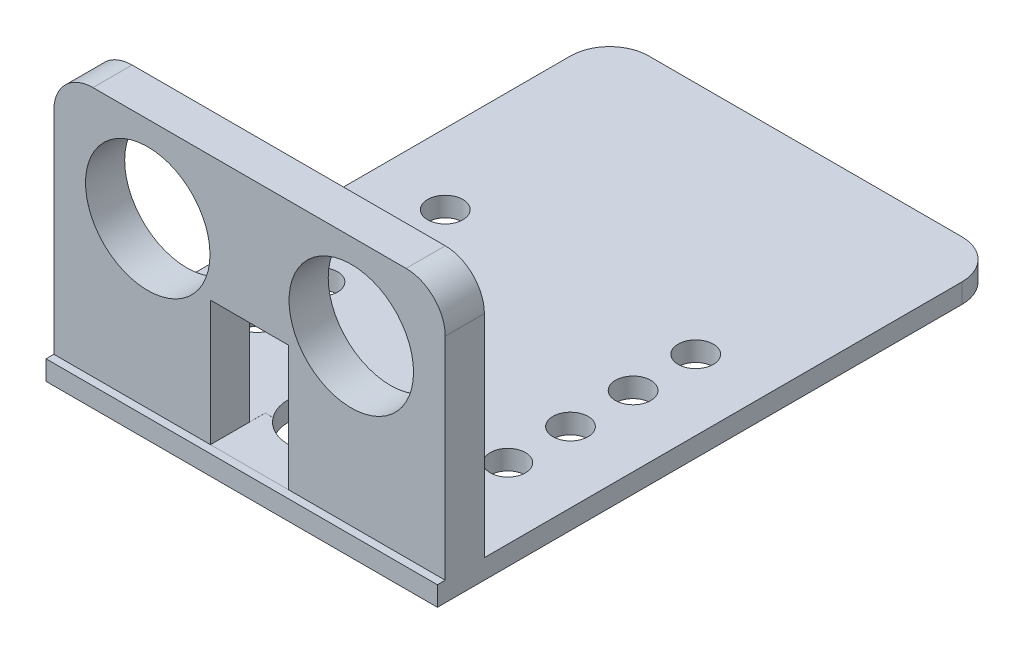
from build123d import *

# Parameters (mm, degrees)
SKETCH1_R           = 2.25
BOSS_EXTRUDE1_DEPTH = 2.5
SKETCH3_W           = 50
SKETCH3_H           = 5
BOSS_EXTRUDE2_DEPTH = 32
SKETCH7_R           = 5
CUT_EXTRUDE3_DEPTH  = 7
SKETCH5_R           = 7.95
SKETCH5_W           = 10
SKETCH5_H           = 16
CUT_EXTRUDE1_DEPTH  = 7
SKETCH8_W           = 50
SKETCH8_H           = 18
CUT_EXTRUDE4_DEPTH  = 46.265881191
SKETCH9_W           = 50
SKETCH9_H           = 2.5
BOSS_EXTRUDE3_DEPTH = 50
SKETCH10_R          = 2.25
CUT_EXTRUDE5_DEPTH  = 81.925892025
FILLET1_R           = 5


with BuildPart() as part:
    # Sketch1 → Boss-Extrude1 (new body)
    with BuildSketch(Plane(origin=(0, 0, 0), x_dir=(1, 0, 0), z_dir=(0, 1, 0))):
        Polygon((-12, -20), (12, -20), (12, -2), (16, -2), (16, -20), (25, -20), (25, 20), (-25, 20), (-25, -20), (-16, -20), (-16, -2), (-12, -2), align=None)
        with Locations(Location((-16, 16, 0), (0, 0, 270))):
            Circle(SKETCH1_R, mode=Mode.SUBTRACT)
        with Locations(Location((-16, 8, 0), (0, 0, 270))):
            Circle(SKETCH1_R, mode=Mode.SUBTRACT)
        with Locations(Location((16, 16, 0), (0, 0, 270))):
            Circle(SKETCH1_R, mode=Mode.SUBTRACT)
        with Locations(Location((16, 8, 0), (0, 0, 270))):
            Circle(SKETCH1_R, mode=Mode.SUBTRACT)
    extrude(amount=BOSS_EXTRUDE1_DEPTH)

    # Sketch3 → Boss-Extrude2 (add)
    with BuildSketch(Plane(origin=(0, 2.5, 0), x_dir=(1, 0, 0), z_dir=(0, 1, 0))):
        with Locations((0, 1.5)):
            Rectangle(SKETCH3_W, SKETCH3_H)
    extrude(amount=BOSS_EXTRUDE2_DEPTH)

    # Sketch7 → Cut-Extrude3 (cut)
    with BuildSketch(Plane(origin=(0, 2.5, 0), x_dir=(1, 0, 0), z_dir=(0, 1, 0))):
        with Locations(Location((0, 9, 0), (0, 0, 270))):
            Circle(SKETCH7_R)
    extrude(amount=-CUT_EXTRUDE3_DEPTH, mode=Mode.SUBTRACT)

    # Sketch5 → Cut-Extrude1 (cut)
    with BuildSketch(Plane.XY.offset(1)):
        with Locations((-13, 23.5)):
            Circle(SKETCH5_R)
        with Locations((13, 23.5)):
            Circle(SKETCH5_R)
        with Locations((0, 10.494306312)):
            Rectangle(SKETCH5_W, SKETCH5_H)
    extrude(amount=-CUT_EXTRUDE1_DEPTH, mode=Mode.SUBTRACT)

    # Sketch8 → Cut-Extrude4 (cut, through all)
    with BuildSketch(Plane(origin=(0, 2.5, 0), x_dir=(1, 0, 0), z_dir=(0, 1, 0))):
        with Locations((0, -11)):
            Rectangle(SKETCH8_W, SKETCH8_H)
    extrude(amount=-CUT_EXTRUDE4_DEPTH, mode=Mode.SUBTRACT)

    # Sketch9 → Boss-Extrude3 (add)
    with BuildSketch(Plane(origin=(0, 0, -20), x_dir=(-1, 0, 0), z_dir=(0, 0, -1))):
        with Locations((0, 1.25)):
            Rectangle(SKETCH9_W, SKETCH9_H)
    extrude(amount=BOSS_EXTRUDE3_DEPTH)

    # Sketch10 → Cut-Extrude5 (cut, through all)
    with BuildSketch(Plane(origin=(0, 2.5, 0), x_dir=(1, 0, 0), z_dir=(0, 1, 0))):
        with Locations(Location((-16, 16, 0), (0, 0, 270))):
            Circle(SKETCH10_R)
        with Locations(Location((-16, 24, 0), (0, 0, 270))):
            Circle(SKETCH10_R)
        with Locations(Location((-16, 32, 0), (0, 0, 270))):
            Circle(SKETCH10_R)
        with Locations(Location((-16, 40, 0), (0, 0, 270))):
            Circle(SKETCH10_R)
        with Locations(Location((16, 40, 0), (0, 0, 90))):
            Circle(SKETCH10_R)
        with Locations(Location((16, 32, 0), (0, 0, 90))):
            Circle(SKETCH10_R)
        with Locations(Location((16, 24, 0), (0, 0, 90))):
            Circle(SKETCH10_R)
    extrude(amount=-CUT_EXTRUDE5_DEPTH, mode=Mode.SUBTRACT)

    # Fillet1
    fillet1_edges = [part.edges().sort_by_distance(p)[0] for p in [
        (25, 1.25, -70),
        (-25, 1.25, -70),
        (-25, 34.5, -1.5),
        (25, 34.5, -1.5),
    ]]
    fillet(fillet1_edges, radius=FILLET1_R)


solid = part.part
